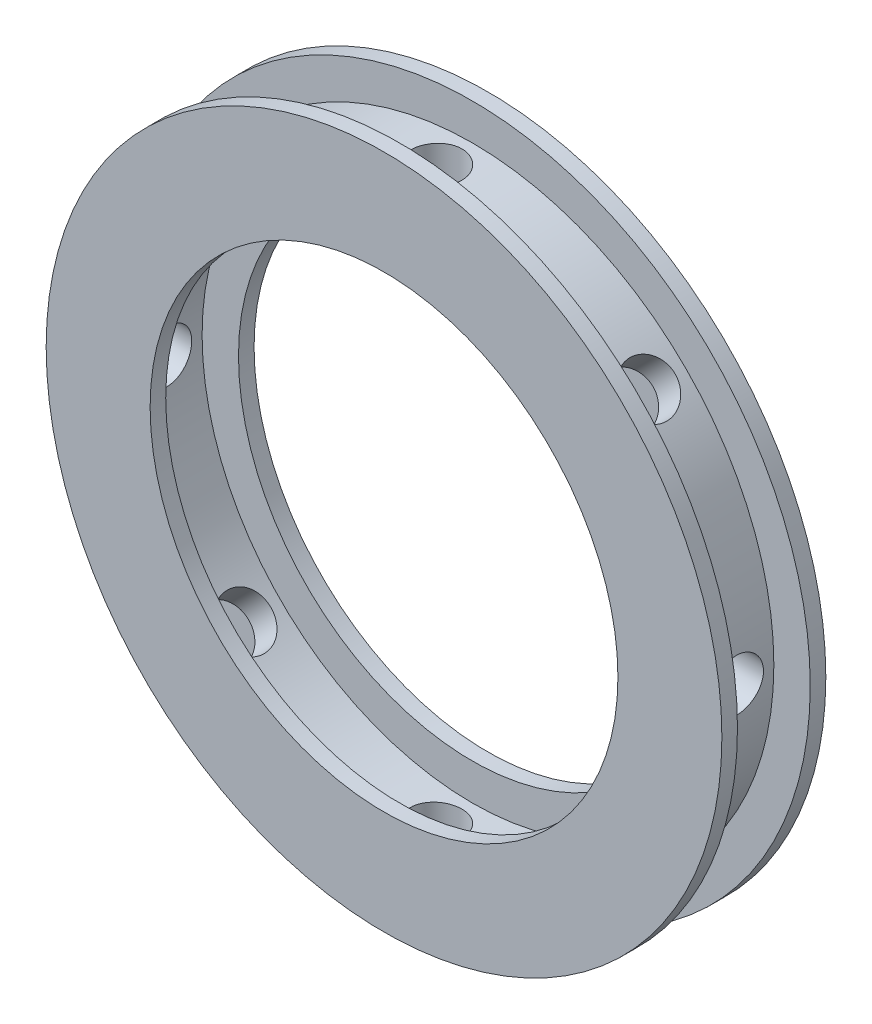
from build123d import *

# Parameters (mm, degrees)
SKETCH2_R          = 2.5
CUT_EXTRUDE1_DEPTH = 47.233105022
CIRPATTERN1_COUNT  = 8


with BuildPart() as part:
    # Sketch1 → Revolve1 (revolve)
    with BuildSketch(Plane(origin=(0, 0, 0), x_dir=(0, 0, -1), z_dir=(1, 0, 0)), mode=Mode.PRIVATE) as revolve1_sk:
        Polygon((5, 32.5), (5, 22.5), (3.5, 22.5), (3.5, 26), (-3.5, 26), (-3.5, 22.5), (-5, 22.5), (-5, 32.5), (-3.5, 32.5), (-3.5, 29), (3.5, 29), (3.5, 32.5), align=None)
    revolve(revolve1_sk.sketch.rotate(Axis((0, 0, 0), (0, 0, 1)), 90), axis=Axis((0, 0, 0), (0, 0, 1)))

    # Sketch2 → Cut-Extrude1 (cut, through all)
    with BuildSketch(Plane(origin=(0, 0, 0), x_dir=(1, 0, 0), z_dir=(0, 1, 0))):
        with Locations(Location((0, 0, 0), (0, 0, 270))):
            Circle(SKETCH2_R)
    cut_extrude1 = extrude(amount=-CUT_EXTRUDE1_DEPTH, mode=Mode.SUBTRACT)

    # CirPattern1: Cut-Extrude1 ×8 about axis
    cirpattern1_axis = Axis((0, 0, 0), (0, 0, -1))
    for i in range(1, CIRPATTERN1_COUNT):
        add(cut_extrude1.rotate(cirpattern1_axis, i * 360 / CIRPATTERN1_COUNT), mode=Mode.SUBTRACT)


solid = part.part
